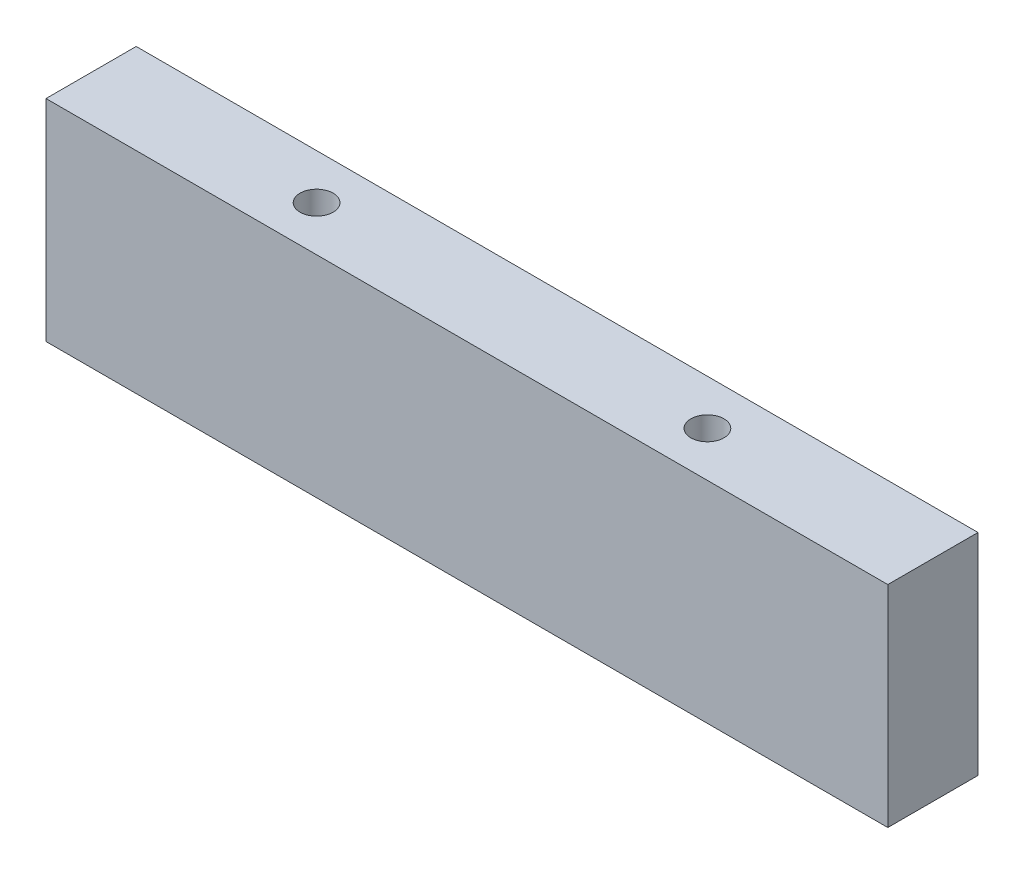
from build123d import *

# Parameters (mm, degrees)
SKETCH1_W           = 280
SKETCH1_H           = 70
BOSS_EXTRUDE1_DEPTH = 30
SKETCH2_R           = 5.5
CUT_EXTRUDE1_DEPTH  = 80


with BuildPart() as part:
    # Sketch1 → Boss-Extrude1 (new body)
    with BuildSketch(Plane.XY):
        Rectangle(SKETCH1_W, SKETCH1_H)
    extrude(amount=BOSS_EXTRUDE1_DEPTH)

    # Sketch2 → Cut-Extrude1 (cut)
    with BuildSketch(Plane(origin=(0, 35, 0), x_dir=(1, 0, 0), z_dir=(0, 1, 0))):
        with Locations(Location((-65, -15, 0), (0, 0, 270))):
            Circle(SKETCH2_R)
        with Locations(Location((65, -15, 0), (0, 0, 270))):
            Circle(SKETCH2_R)
    extrude(amount=-CUT_EXTRUDE1_DEPTH, mode=Mode.SUBTRACT)


solid = part.part
